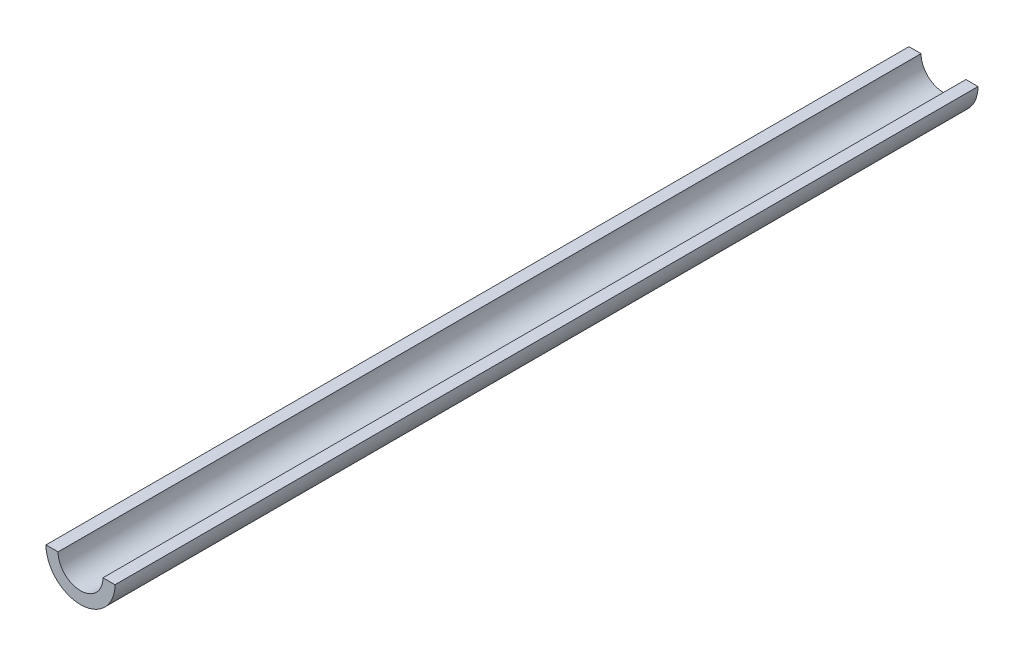
from build123d import *

# Parameters (mm, degrees)
EXTRUDE_1_DEPTH = 125


with BuildPart() as part:
    # 草图1 → 凸台-拉伸1 (new, symmetric)
    with BuildSketch(Plane.XY):
        with BuildLine():
            Line((6.5, 0), (10, 0))
            ThreePointArc((10, 0), (0, -10), (-10, 0))
            Line((-10, 0), (-6.5, 0))
            ThreePointArc((-6.5, 0), (0, -6.5), (6.5, 0))
        make_face()
    extrude(amount=EXTRUDE_1_DEPTH, both=True)


solid = part.part
